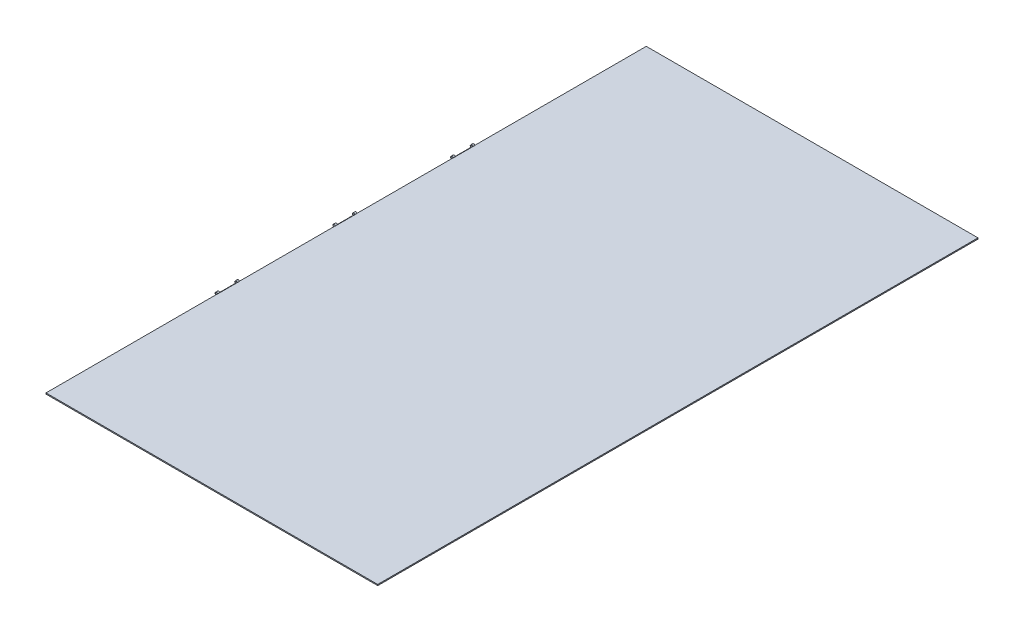
from build123d import *

# Parameters (mm, degrees)
SKETCH1_W                   = 1521.5
SKETCH1_H                   = 2753.2
BOSS_EXTRUDE1_DEPTH         = 5
SKETCH4_R                   = 6
SKETCH4_R_2                 = 5
BOSS_EXTRUDE3_DEPTH         = 50
SKETCH5_W                   = 80
SKETCH5_H                   = 12
CUT_EXTRUDE1_DEPTH          = 12
LPATTERN1_COUNT             = 2
LPATTERN1_PITCH             = 540
LPATTERN2_COUNT             = 2
LPATTERN2_PITCH             = 540
LPATTERN2_COPY_1_SKETCH_R   = 6
LPATTERN2_COPY_1_SKETCH_R_2 = 5
LPATTERN2_COPY_1_DEPTH      = 50
LPATTERN2_COPY_2_SKETCH_W   = 80
LPATTERN2_COPY_2_SKETCH_H   = 12
LPATTERN2_COPY_2_DEPTH      = 12


with BuildPart() as part:
    # Sketch1 → Boss-Extrude1 (new body)
    with BuildSketch(Plane(origin=(0, 0, 0), x_dir=(1, 0, 0), z_dir=(0, 1, 0))):
        Rectangle(SKETCH1_W, SKETCH1_H)
    extrude(amount=BOSS_EXTRUDE1_DEPTH)

    # Sketch4 → Boss-Extrude3 (add, symmetric)
    with BuildSketch(Plane.XY):
        with Locations((-765.75, 2.799008647)):
            Circle(SKETCH4_R)
        with Locations((-765.75, 2.799008647)):
            Circle(SKETCH4_R_2, mode=Mode.SUBTRACT)
    boss_extrude3 = extrude(amount=BOSS_EXTRUDE3_DEPTH, both=True)

    # Sketch5 → Cut-Extrude1 (cut)
    with BuildSketch(Plane.ZY.offset(760.75)):
        with Locations((0, 2.799008647)):
            Rectangle(SKETCH5_W, SKETCH5_H)
    cut_extrude1 = extrude(amount=CUT_EXTRUDE1_DEPTH, mode=Mode.SUBTRACT)

    # LPattern1: Boss-Extrude3, Cut-Extrude1 ×2
    with Locations(*[(0, 0, -i * LPATTERN1_PITCH) for i in range(1, LPATTERN1_COUNT)]):
        add(boss_extrude3)
        add(cut_extrude1, mode=Mode.SUBTRACT)

    # LPattern2: Boss-Extrude3, Cut-Extrude1 ×2
    with Locations(*[(0, 0, i * LPATTERN2_PITCH) for i in range(1, LPATTERN2_COUNT)]):
        add(boss_extrude3)
        add(cut_extrude1, mode=Mode.SUBTRACT)

    # LPattern2 copy 1 sketch → LPattern2 copy 1 (add, symmetric)
    with BuildSketch(Plane.XY):
        with Locations((-765.75, 2.799008647)):
            Circle(LPATTERN2_COPY_1_SKETCH_R)
        with Locations((-765.75, 2.799008647)):
            Circle(LPATTERN2_COPY_1_SKETCH_R_2, mode=Mode.SUBTRACT)
    extrude(amount=LPATTERN2_COPY_1_DEPTH, both=True)

    # LPattern2 copy 2 sketch → LPattern2 copy 2 (cut)
    with BuildSketch(Plane.ZY.offset(760.75)):
        with Locations((0, 2.799008647)):
            Rectangle(LPATTERN2_COPY_2_SKETCH_W, LPATTERN2_COPY_2_SKETCH_H)
    extrude(amount=LPATTERN2_COPY_2_DEPTH, mode=Mode.SUBTRACT)


solid = part.part
